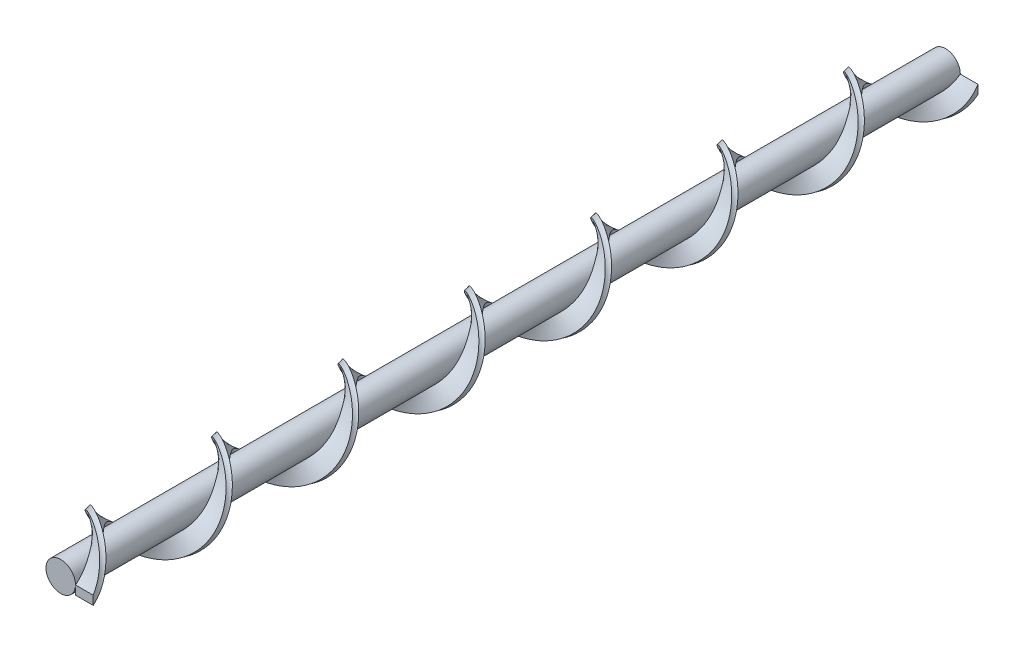
from build123d import *

# Parameters (mm, degrees)
SKETCH1_R           = 2.5
BOSS_EXTRUDE1_DEPTH = 150
SWEEP5_PITCH        = 21.428571429
SWEEP5_HEIGHT       = 150
SWEEP5_RADIUS       = 2.5
SKETCH12_W          = 3
SKETCH12_H          = 1.5


with BuildPart() as part:
    # Sketch1 → Boss-Extrude1 (new body)
    with BuildSketch(Plane.XY):
        Circle(SKETCH1_R)
    extrude(amount=BOSS_EXTRUDE1_DEPTH)


with BuildPart() as body_2:
    # Sweep5: sweep along a helix
    with BuildLine() as sweep5_path:
        Helix(SWEEP5_PITCH, SWEEP5_HEIGHT, SWEEP5_RADIUS, center=(0, 0, 0), direction=(0, 0, 1), lefthand=True)
    # Sketch12 → Sweep5 (sweep)
    with BuildSketch(Plane(origin=(0, 0, 0), x_dir=(-1, 0, 0), z_dir=(0, 0, -1))):
        with Locations((-4, -0.75)):
            Rectangle(SKETCH12_W, SKETCH12_H)
    sweep(path=sweep5_path.line, is_frenet=True)


solid = Compound([part.part, body_2.part])
